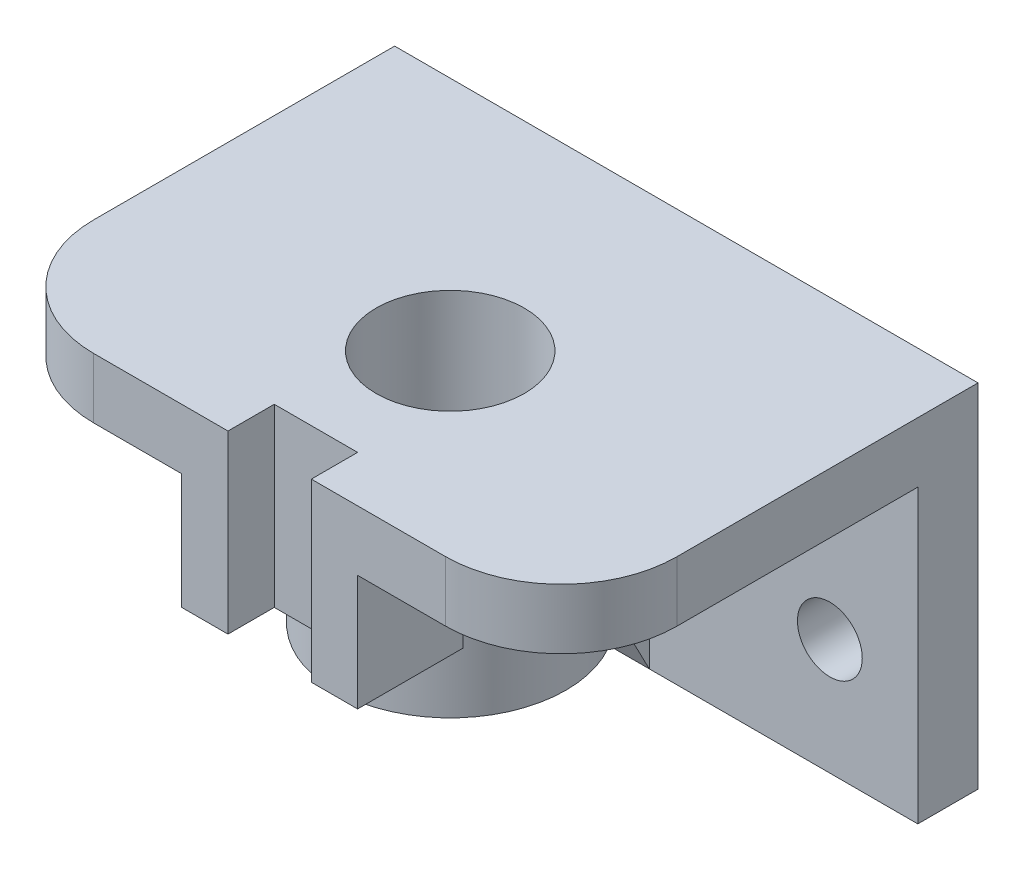
from build123d import *
from build123d.topology import SkipClean

# Parameters (mm, degrees)
SKETCH1_W                = 63
SKETCH1_H                = 76
BOSS_EXTRUDE1_DEPTH      = 13
SKETCH2_W                = 63
SKETCH2_H                = 13
BOSS_EXTRUDE2_DEPTH      = 77
FILLET1_R                = 25
BOSS_EXTRUDE3_DEPTH      = 38
SKETCH5_W                = 9
SKETCH5_H                = 10
CUT_EXTRUDE1_DEPTH       = 77
BOSS_EXTRUDE4_REACH      = 135.585
BOSS_EXTRUDE4_END_RADIUS = 25
SKETCH6_W                = 10
SKETCH6_H                = 25
BOSS_EXTRUDE5_REACH      = 129.063
SKETCH7_W                = 9
SKETCH7_H                = 25
RIB1_REACH               = 132.173
SKETCH8_WALLS_W          = 5
SKETCH8_WALLS_H          = 290.523203692
SKETCH9_R                = 7
CUT_EXTRUDE2_DEPTH       = 167.075284133
CUT_EXTRUDE3_START       = -28
SKETCH10_R               = 16
CUT_EXTRUDE3_DEPTH       = 23
SKETCH11_R               = 7
CUT_EXTRUDE4_DEPTH       = 167.075284133


with BuildPart() as part:
    # Sketch1 → Boss-Extrude1 (new body)
    with BuildSketch(Plane.XY):
        with Locations((31.5, 38)):
            Rectangle(SKETCH1_W, SKETCH1_H)
    extrude(amount=BOSS_EXTRUDE1_DEPTH)

    # Sketch2 → Boss-Extrude2 (add)
    with BuildSketch(Plane.XY.offset(13)):
        with Locations((31.5, 69.5)):
            Rectangle(SKETCH2_W, SKETCH2_H)
    extrude(amount=BOSS_EXTRUDE2_DEPTH)

    # Fillet1
    fillet1_edges = [part.edges().sort_by_distance(p)[0] for p in [
        (0, 69.5, 90),
    ]]
    fillet(fillet1_edges, radius=FILLET1_R)

    # Sketch4 → Boss-Extrude3 (add)
    with BuildSketch(Plane(origin=(0, 25, 0), x_dir=(-1, 0, 0), z_dir=(0, -1, 0))):
        with BuildLine():
            Line((-63, -76), (-63, -67))
            ThreePointArc((-63, -67), (-47, -51), (-63, -35))
            Line((-63, -35), (-63, -26))
            ThreePointArc((-63, -26), (-38, -51), (-63, -76))
        make_face()
    extrude(amount=-BOSS_EXTRUDE3_DEPTH)

    # Sketch5 → Cut-Extrude1 (cut)
    with BuildSketch(Plane.XZ.offset(-63)):
        with Locations((58.5, 85)):
            Rectangle(SKETCH5_W, SKETCH5_H)
    extrude(amount=-CUT_EXTRUDE1_DEPTH, mode=Mode.SUBTRACT)

    # Boss-Extrude4: up to this cylinder (the profile starts outside it)
    boss_extrude4_end = Plane(origin=(63, 50.5, 51), z_dir=(0, -1, 0)) * Cylinder(BOSS_EXTRUDE4_END_RADIUS, 322.17, mode=Mode.PRIVATE)
    # Sketch6 → Boss-Extrude4 (add, up to the surface)
    with BuildSketch(Plane.XY.offset(90), mode=Mode.PRIVATE) as boss_extrude4_sk1:
        with Locations((49, 50.5)):
            Rectangle(SKETCH6_W, SKETCH6_H)
    boss_extrude4_tool1 = extrude(boss_extrude4_sk1.sketch, amount=-BOSS_EXTRUDE4_REACH, mode=Mode.PRIVATE) - boss_extrude4_end
    add(boss_extrude4_tool1.solids().sort_by_distance((49, 50.5, 90))[0])

    # Sketch7 → Boss-Extrude5 (add, up to next)
    with BuildSketch(Plane.XY.offset(80), mode=Mode.PRIVATE) as boss_extrude5_sk1:
        with Locations((58.5, 50.5)):
            Rectangle(SKETCH7_W, SKETCH7_H)
    boss_extrude5_tool1 = extrude(boss_extrude5_sk1.sketch, amount=-BOSS_EXTRUDE5_REACH, mode=Mode.PRIVATE) - part.part
    add(boss_extrude5_tool1.solids().sort_by_distance((58.5, 50.5, 80))[0])

    # Sketch8 walls → Rib1 (add, up to next)
    with BuildSketch(Plane(origin=(0, -5.32115869, 10.232997481), x_dir=(1, 0, 0), z_dir=(0, -0.4613527366419895, 0.8872168012345952)), mode=Mode.PRIVATE) as rib1_sk1:
        with Locations((60.5, 20.08658838)):
            Rectangle(SKETCH8_WALLS_W, SKETCH8_WALLS_H)
    rib1_tool1 = extrude(rib1_sk1.sketch, amount=-RIB1_REACH, mode=Mode.PRIVATE) - part.part
    add(rib1_tool1.solids().sort_by_distance((63, 12.5, 19.5))[0])

    # Mirror1: part across plane


with BuildPart() as part_1:
    with SkipClean():  # the faces are left unmerged after this step: merging them gives an invalid solid
        add(part.part)
        add(part.part.mirror(Plane(origin=(63, 76, 13), x_dir=(0, 0, 1), z_dir=(1, 0, 0))))

    # Sketch9 → Cut-Extrude2 (cut, through all)
    with SkipClean():  # the faces are left unmerged after this step: merging them gives an invalid solid
        with BuildSketch(Plane.XY.offset(13)):
            with Locations((19, 25)):
                Circle(SKETCH9_R)
        extrude(amount=-CUT_EXTRUDE2_DEPTH, mode=Mode.SUBTRACT)

    # Sketch10 → Cut-Extrude3 (cut)
    with SkipClean():  # the faces are left unmerged after this step: merging them gives an invalid solid
        with BuildSketch(Plane.XZ.offset(-25).offset(CUT_EXTRUDE3_START)):
            with Locations(Location((63, 51, 0), (0, 0, 270))):
                Circle(SKETCH10_R)
        extrude(amount=-CUT_EXTRUDE3_DEPTH, mode=Mode.SUBTRACT)

    # Sketch11 → Cut-Extrude4 (cut, through all)
    with SkipClean():  # the faces are left unmerged after this step: merging them gives an invalid solid
        with BuildSketch(Plane.XY.offset(13)):
            with Locations((107, 25)):
                Circle(SKETCH11_R)
        extrude(amount=-CUT_EXTRUDE4_DEPTH, mode=Mode.SUBTRACT)


solid = part_1.part
